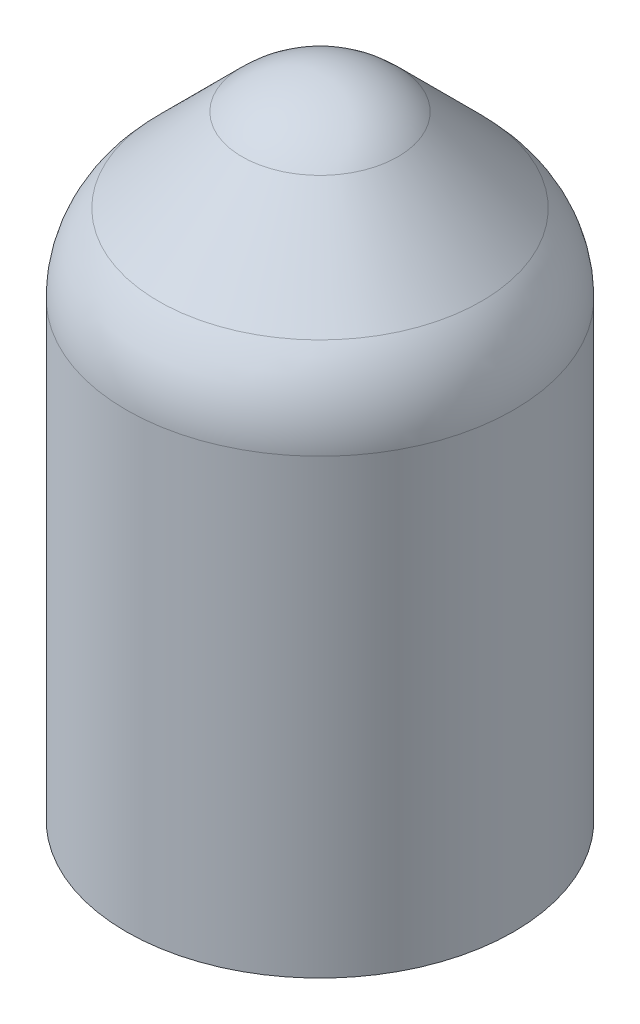
from build123d import *

# Parameters (mm, degrees)
SHELL1_T = -2


with BuildPart() as part:
    # Sketch1 → Revolve1 (revolve)
    with BuildSketch(Plane.XY, mode=Mode.PRIVATE) as revolve1_sk:
        with BuildLine():
            Line((50, 164.142135624), (24.142135624, 190))
            ThreePointArc((24.142135624, 190), (13.065629649, 197.401084675), (0, 200))
            Line((0, 200), (0, 140))
            Line((0, 140), (0, 0))
            Line((0, 0), (60, 0))
            Line((60, 0), (60, 140))
            ThreePointArc((60, 140), (57.401084675, 153.065629649), (50, 164.142135624))
        make_face()
    revolve(revolve1_sk.sketch.rotate(Axis((0, 0, 0), (0, 1, 0)), 90), axis=Axis((0, 0, 0), (0, 1, 0)))

    # Shell1
    shell1_openings = [part.faces().sort_by_distance(p)[0] for p in [
        (0, 0, 0),
    ]]
    offset(amount=SHELL1_T, openings=shell1_openings, kind=Kind.INTERSECTION)


solid = part.part
